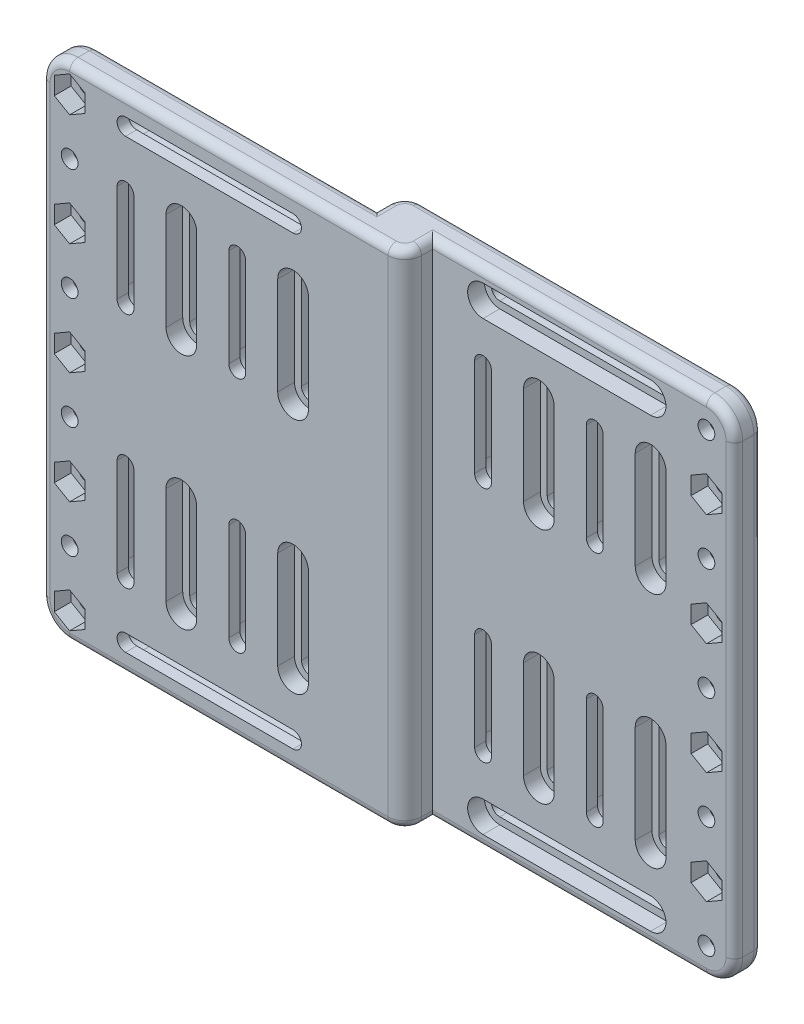
from build123d import *

# Parameters (mm, degrees)
EXTRUDE_2_DEPTH              = 5
EXTRUDE_3_DEPTH              = 5
SKETCH_4_R                   = 1.5
CUT_EXTRUDE_1_DEPTH          = 76.663729752
CUT_EXTRUDE_2_DEPTH          = 3
SKETCH_6_R                   = 1.5
CUT_EXTRUDE_3_DEPTH          = 76.663729752
CUT_EXTRUDE_4_DEPTH          = 3
PATTERN_LINEAR_1_COUNT       = 5
PATTERN_LINEAR_1_PITCH       = 10
PATTERN_LINEAR_1_COL_COUNT   = 5
PATTERN_LINEAR_1_COL_PITCH   = 10
PATTERN_LINEAR_2_COUNT       = 5
PATTERN_LINEAR_2_PITCH       = 10
PATTERN_LINEAR_2_COL_COUNT   = 5
PATTERN_LINEAR_2_COL_PITCH   = 10
PATTERN_LINEAR_9_COUNT       = 3
PATTERN_LINEAR_9_PITCH       = 20
PATTERN_LINEAR_9_COL_COUNT   = 3
PATTERN_LINEAR_9_COL_PITCH   = 20
PATTERN_LINEAR_10_COUNT      = 3
PATTERN_LINEAR_10_PITCH      = 20
PATTERN_LINEAR_10_COL_COUNT  = 3
PATTERN_LINEAR_10_COL_PITCH  = 20
CUT_EXTRUDE_15_DEPTH         = 3
CUT_EXTRUDE_16_DEPTH         = 3
PATTERN_LINEAR_11_COUNT      = 3
PATTERN_LINEAR_11_PITCH      = 20
PATTERN_LINEAR_11_COUNT_DIR2 = 3
PATTERN_LINEAR_11_PITCH_DIR2 = 20
PATTERN_LINEAR_12_COUNT      = 3
PATTERN_LINEAR_12_PITCH      = 20
PATTERN_LINEAR_12_COUNT_DIR2 = 3
PATTERN_LINEAR_12_PITCH_DIR2 = 20
CUT_EXTRUDE_5_DEPTH          = 76.166481892
CUT_EXTRUDE_6_DEPTH          = 3
CUT_EXTRUDE_7_DEPTH          = 76.166481892
CUT_EXTRUDE_8_DEPTH          = 3
CUT_EXTRUDE_9_DEPTH          = 76.166481892
CUT_EXTRUDE_10_DEPTH         = 76.166481892
PATTERN_LINEAR_3_COUNT       = 4
PATTERN_LINEAR_3_PITCH       = 10
PATTERN_LINEAR_4_COUNT       = 4
PATTERN_LINEAR_4_PITCH       = 10
CUT_EXTRUDE_11_DEPTH         = 3
CUT_EXTRUDE_12_DEPTH         = 3
PATTERN_LINEAR_6_COUNT       = 2
PATTERN_LINEAR_6_PITCH       = 20
PATTERN_LINEAR_13_COUNT      = 2
PATTERN_LINEAR_13_PITCH      = 20
CUT_EXTRUDE_13_DEPTH         = 3
CUT_EXTRUDE_14_DEPTH         = 3
PATTERN_LINEAR_8_COUNT       = 2
PATTERN_LINEAR_8_PITCH       = 20
PATTERN_LINEAR_14_COUNT      = 2
PATTERN_LINEAR_14_PITCH      = 20
FILLET_2_R                   = 3
FILLET_3_R                   = 5
FILLET_4_R                   = 1.5


with BuildPart() as part:
    # 草图2 → 凸台-拉伸2 (new body)
    with BuildSketch(Plane.XY):
        Polygon((0, 45), (5, 45), (5, -45), (0, -45), (-60, -45), (-60, 45), align=None)
    extrude(amount=EXTRUDE_2_DEPTH)

    # 草图3 → 凸台-拉伸3 (add)
    with BuildSketch(Plane(origin=(0, 0, 0), x_dir=(-1, 0, 0), z_dir=(0, 0, -1))):
        Polygon((0, 45), (5, 45), (5, -45), (0, -45), (-59, -45), (-59, 45), align=None)
    extrude(amount=EXTRUDE_3_DEPTH)

    # 草图4 → 切除-拉伸1 (cut, through all)
    with BuildSketch(Plane(origin=(0, 0, -5), x_dir=(-1, 0, 0), z_dir=(0, 0, -1))):
        with Locations((-54, 0)):
            Circle(SKETCH_4_R)
    cut_extrude_1 = extrude(amount=-CUT_EXTRUDE_1_DEPTH, mode=Mode.SUBTRACT)

    # 草图5 → 切除-拉伸2 (cut)
    with BuildSketch(Plane(origin=(0, 0, -5), x_dir=(-1, 0, 0), z_dir=(0, 0, -1))):
        Polygon((-54, -3.175426481), (-51.25, -1.58771324), (-51.25, 1.58771324), (-54, 3.175426481), (-56.75, 1.58771324), (-56.75, -1.58771324), align=None)
    cut_extrude_2 = extrude(amount=-CUT_EXTRUDE_2_DEPTH, mode=Mode.SUBTRACT)

    # 草图6 → 切除-拉伸3 (cut, through all)
    with BuildSketch(Plane.XY.offset(5)):
        with Locations((-55, 0)):
            Circle(SKETCH_6_R)
    cut_extrude_3 = extrude(amount=-CUT_EXTRUDE_3_DEPTH, mode=Mode.SUBTRACT)

    # 草图7 → 切除-拉伸4 (cut)
    with BuildSketch(Plane.XY.offset(5)):
        Polygon((-55, 3.175426481), (-57.75, 1.58771324), (-57.75, -1.58771324), (-55, -3.175426481), (-52.25, -1.58771324), (-52.25, 1.58771324), align=None)
    cut_extrude_4 = extrude(amount=-CUT_EXTRUDE_4_DEPTH, mode=Mode.SUBTRACT)

    # 阵列(线性)1: 切除-拉伸1 ×5
    with Locations(*[(0, -i * PATTERN_LINEAR_1_PITCH, 0) for i in range(1, PATTERN_LINEAR_1_COUNT)]):
        add(cut_extrude_1, mode=Mode.SUBTRACT)

    # 阵列(线性)1 col: 切除-拉伸1 ×5
    with Locations(*[(0, i * PATTERN_LINEAR_1_COL_PITCH, 0) for i in range(1, PATTERN_LINEAR_1_COL_COUNT)]):
        add(cut_extrude_1, mode=Mode.SUBTRACT)

    # 阵列(线性)2: 切除-拉伸3 ×5
    with Locations(*[(0, -i * PATTERN_LINEAR_2_PITCH, 0) for i in range(1, PATTERN_LINEAR_2_COUNT)]):
        add(cut_extrude_3, mode=Mode.SUBTRACT)

    # 阵列(线性)2 col: 切除-拉伸3 ×5
    with Locations(*[(0, i * PATTERN_LINEAR_2_COL_PITCH, 0) for i in range(1, PATTERN_LINEAR_2_COL_COUNT)]):
        add(cut_extrude_3, mode=Mode.SUBTRACT)

    # 阵列(线性)9: 切除-拉伸2 ×3
    with Locations(*[(0, i * PATTERN_LINEAR_9_PITCH, 0) for i in range(1, PATTERN_LINEAR_9_COUNT)]):
        add(cut_extrude_2, mode=Mode.SUBTRACT)

    # 阵列(线性)9 col: 切除-拉伸2 ×3
    with Locations(*[(0, -i * PATTERN_LINEAR_9_COL_PITCH, 0) for i in range(1, PATTERN_LINEAR_9_COL_COUNT)]):
        add(cut_extrude_2, mode=Mode.SUBTRACT)

    # 阵列(线性)10: 切除-拉伸4 ×3
    with Locations(*[(0, i * PATTERN_LINEAR_10_PITCH, 0) for i in range(1, PATTERN_LINEAR_10_COUNT)]):
        add(cut_extrude_4, mode=Mode.SUBTRACT)

    # 阵列(线性)10 col: 切除-拉伸4 ×3
    with Locations(*[(0, -i * PATTERN_LINEAR_10_COL_PITCH, 0) for i in range(1, PATTERN_LINEAR_10_COL_COUNT)]):
        add(cut_extrude_4, mode=Mode.SUBTRACT)

    # 草图19 → 切除-拉伸15 (cut)
    with BuildSketch(Plane.XY):
        Polygon((54, 13.175426481), (51.25, 11.58771324), (51.25, 8.41228676), (54, 6.824573519), (56.75, 8.41228676), (56.75, 11.58771324), align=None)
    cut_extrude_15 = extrude(amount=-CUT_EXTRUDE_15_DEPTH, mode=Mode.SUBTRACT)

    # 草图20 → 切除-拉伸16 (cut)
    with BuildSketch(Plane(origin=(0, 0, 0), x_dir=(-1, 0, 0), z_dir=(0, 0, -1))):
        Polygon((55, 6.824573519), (57.75, 8.41228676), (57.75, 11.58771324), (55, 13.175426481), (52.25, 11.58771324), (52.25, 8.41228676), align=None)
    cut_extrude_16 = extrude(amount=-CUT_EXTRUDE_16_DEPTH, mode=Mode.SUBTRACT)

    # 阵列(线性)11: Cut-Extrude 15 3 × 3
    with Locations(*[Vector(0, -1, 0) * (i * PATTERN_LINEAR_11_PITCH) + Vector(0, 1, 0) * (j * PATTERN_LINEAR_11_PITCH_DIR2) for i in range(PATTERN_LINEAR_11_COUNT) for j in range(PATTERN_LINEAR_11_COUNT_DIR2) if (i, j) != (0, 0)]):
        add(cut_extrude_15, mode=Mode.SUBTRACT)

    # 阵列(线性)12: Cut-Extrude 16 3 × 3
    with Locations(*[Vector(0, -1, 0) * (i * PATTERN_LINEAR_12_PITCH) + Vector(0, 1, 0) * (j * PATTERN_LINEAR_12_PITCH_DIR2) for i in range(PATTERN_LINEAR_12_COUNT) for j in range(PATTERN_LINEAR_12_COUNT_DIR2) if (i, j) != (0, 0)]):
        add(cut_extrude_16, mode=Mode.SUBTRACT)

    # 草图9 → 切除-拉伸5 (cut, through all)
    with BuildSketch(Plane(origin=(0, 0, 0), x_dir=(-1, 0, 0), z_dir=(0, 0, -1))):
        with BuildLine():
            Line((15, 41.5), (45, 41.5))
            ThreePointArc((45, 41.5), (46.5, 40), (45, 38.5))
            Line((45, 38.5), (15, 38.5))
            ThreePointArc((15, 38.5), (13.5, 40), (15, 41.5))
        make_face()
        with BuildLine():
            Line((15, -41.5), (45, -41.5))
            ThreePointArc((45, -41.5), (46.5, -40), (45, -38.5))
            Line((45, -38.5), (15, -38.5))
            ThreePointArc((15, -38.5), (13.5, -40), (15, -41.5))
        make_face()
    extrude(amount=-CUT_EXTRUDE_5_DEPTH, mode=Mode.SUBTRACT)

    # 草图11 → 切除-拉伸6 (cut)
    with BuildSketch(Plane(origin=(0, 0, 0), x_dir=(-1, 0, 0), z_dir=(0, 0, -1))):
        with BuildLine():
            Line((15, 42.75), (45, 42.75))
            ThreePointArc((45, 42.75), (47.75, 40), (45, 37.25))
            Line((45, 37.25), (15, 37.25))
            ThreePointArc((15, 37.25), (12.25, 40), (15, 42.75))
        make_face()
        with BuildLine():
            Line((15, -37.25), (45, -37.25))
            ThreePointArc((45, -37.25), (47.75, -40), (45, -42.75))
            Line((45, -42.75), (15, -42.75))
            ThreePointArc((15, -42.75), (12.25, -40), (15, -37.25))
        make_face()
    extrude(amount=-CUT_EXTRUDE_6_DEPTH, mode=Mode.SUBTRACT)

    # 草图10 → 切除-拉伸7 (cut, through all)
    with BuildSketch(Plane.XY):
        with BuildLine():
            Line((14, 41.5), (44, 41.5))
            ThreePointArc((44, 41.5), (45.5, 40), (44, 38.5))
            Line((44, 38.5), (14, 38.5))
            ThreePointArc((14, 38.5), (12.5, 40), (14, 41.5))
        make_face()
        with BuildLine():
            Line((14, -41.5), (44, -41.5))
            ThreePointArc((44, -41.5), (45.5, -40), (44, -38.5))
            Line((44, -38.5), (14, -38.5))
            ThreePointArc((14, -38.5), (12.5, -40), (14, -41.5))
        make_face()
    extrude(amount=-CUT_EXTRUDE_7_DEPTH, mode=Mode.SUBTRACT)

    # 草图12 → 切除-拉伸8 (cut)
    with BuildSketch(Plane.XY):
        with BuildLine():
            Line((14, 42.75), (44, 42.75))
            ThreePointArc((44, 42.75), (46.75, 40), (44, 37.25))
            Line((44, 37.25), (14, 37.25))
            ThreePointArc((14, 37.25), (11.25, 40), (14, 42.75))
        make_face()
        with BuildLine():
            Line((14, -37.25), (44, -37.25))
            ThreePointArc((44, -37.25), (46.75, -40), (44, -42.75))
            Line((44, -42.75), (14, -42.75))
            ThreePointArc((14, -42.75), (11.25, -40), (14, -37.25))
        make_face()
    extrude(amount=-CUT_EXTRUDE_8_DEPTH, mode=Mode.SUBTRACT)

    # 草图13 → 切除-拉伸9 (cut, through all)
    with BuildSketch(Plane(origin=(0, 0, 0), x_dir=(-1, 0, 0), z_dir=(0, 0, -1))):
        with BuildLine():
            Line((16.5, 30), (16.5, 12.5))
            ThreePointArc((16.5, 12.5), (15, 11), (13.5, 12.5))
            Line((13.5, 12.5), (13.5, 30))
            ThreePointArc((13.5, 30), (15, 31.5), (16.5, 30))
        make_face()
        with BuildLine():
            Line((16.5, -30), (16.5, -12.5))
            ThreePointArc((16.5, -12.5), (15, -11), (13.5, -12.5))
            Line((13.5, -12.5), (13.5, -30))
            ThreePointArc((13.5, -30), (15, -31.5), (16.5, -30))
        make_face()
    cut_extrude_9 = extrude(amount=-CUT_EXTRUDE_9_DEPTH, mode=Mode.SUBTRACT)

    # 草图14 → 切除-拉伸10 (cut, through all)
    with BuildSketch(Plane.XY):
        with BuildLine():
            Line((12.5, 12.5), (12.5, 30))
            ThreePointArc((12.5, 30), (14, 31.5), (15.5, 30))
            Line((15.5, 30), (15.5, 12.5))
            ThreePointArc((15.5, 12.5), (14, 11), (12.5, 12.5))
        make_face()
        with BuildLine():
            Line((12.5, -12.5), (12.5, -30))
            ThreePointArc((12.5, -30), (14, -31.5), (15.5, -30))
            Line((15.5, -30), (15.5, -12.5))
            ThreePointArc((15.5, -12.5), (14, -11), (12.5, -12.5))
        make_face()
    cut_extrude_10 = extrude(amount=-CUT_EXTRUDE_10_DEPTH, mode=Mode.SUBTRACT)

    # 阵列(线性)3: 切除-拉伸9 ×4
    with Locations(*[(-i * PATTERN_LINEAR_3_PITCH, 0, 0) for i in range(1, PATTERN_LINEAR_3_COUNT)]):
        add(cut_extrude_9, mode=Mode.SUBTRACT)

    # 阵列(线性)4: 切除-拉伸10 ×4
    with Locations(*[(i * PATTERN_LINEAR_4_PITCH, 0, 0) for i in range(1, PATTERN_LINEAR_4_COUNT)]):
        add(cut_extrude_10, mode=Mode.SUBTRACT)

    # 草图15 → 切除-拉伸11 (cut)
    with BuildSketch(Plane(origin=(0, 0, 0), x_dir=(-1, 0, 0), z_dir=(0, 0, -1))):
        with BuildLine():
            Line((47.75, 30), (47.75, 12.5))
            ThreePointArc((47.75, 12.5), (45, 9.75), (42.25, 12.5))
            Line((42.25, 12.5), (42.25, 30))
            ThreePointArc((42.25, 30), (45, 32.75), (47.75, 30))
        make_face()
        with BuildLine():
            Line((47.75, -12.5), (47.75, -30))
            ThreePointArc((47.75, -30), (45, -32.75), (42.25, -30))
            Line((42.25, -30), (42.25, -12.5))
            ThreePointArc((42.25, -12.5), (45, -9.75), (47.75, -12.5))
        make_face()
    cut_extrude_11 = extrude(amount=-CUT_EXTRUDE_11_DEPTH, mode=Mode.SUBTRACT)

    # 草图16 → 切除-拉伸12 (cut)
    with BuildSketch(Plane.XY.offset(5)):
        with BuildLine():
            Line((-12.25, 30), (-12.25, 12.5))
            ThreePointArc((-12.25, 12.5), (-15, 9.75), (-17.75, 12.5))
            Line((-17.75, 12.5), (-17.75, 30))
            ThreePointArc((-17.75, 30), (-15, 32.75), (-12.25, 30))
        make_face()
        with BuildLine():
            Line((-12.25, -12.5), (-12.25, -30))
            ThreePointArc((-12.25, -30), (-15, -32.75), (-17.75, -30))
            Line((-17.75, -30), (-17.75, -12.5))
            ThreePointArc((-17.75, -12.5), (-15, -9.75), (-12.25, -12.5))
        make_face()
    cut_extrude_12 = extrude(amount=-CUT_EXTRUDE_12_DEPTH, mode=Mode.SUBTRACT)

    # 阵列(线性)6: 切除-拉伸12 ×2
    with Locations(*[(-i * PATTERN_LINEAR_6_PITCH, 0, 0) for i in range(1, PATTERN_LINEAR_6_COUNT)]):
        add(cut_extrude_12, mode=Mode.SUBTRACT)

    # 阵列(线性)13: 切除-拉伸11 ×2
    with Locations(*[(i * PATTERN_LINEAR_13_PITCH, 0, 0) for i in range(1, PATTERN_LINEAR_13_COUNT)]):
        add(cut_extrude_11, mode=Mode.SUBTRACT)

    # 草图17 → 切除-拉伸13 (cut)
    with BuildSketch(Plane.XY):
        with BuildLine():
            Line((46.75, 30), (46.75, 12.5))
            ThreePointArc((46.75, 12.5), (44, 9.75), (41.25, 12.5))
            Line((41.25, 12.5), (41.25, 30))
            ThreePointArc((41.25, 30), (44, 32.75), (46.75, 30))
        make_face()
        with BuildLine():
            Line((46.75, -12.5), (46.75, -30))
            ThreePointArc((46.75, -30), (44, -32.75), (41.25, -30))
            Line((41.25, -30), (41.25, -12.5))
            ThreePointArc((41.25, -12.5), (44, -9.75), (46.75, -12.5))
        make_face()
    cut_extrude_13 = extrude(amount=-CUT_EXTRUDE_13_DEPTH, mode=Mode.SUBTRACT)

    # 草图18 → 切除-拉伸14 (cut)
    with BuildSketch(Plane(origin=(0, 0, -5), x_dir=(-1, 0, 0), z_dir=(0, 0, -1))):
        with BuildLine():
            Line((-11.25, 30), (-11.25, 12.5))
            ThreePointArc((-11.25, 12.5), (-14, 9.75), (-16.75, 12.5))
            Line((-16.75, 12.5), (-16.75, 30))
            ThreePointArc((-16.75, 30), (-14, 32.75), (-11.25, 30))
        make_face()
        with BuildLine():
            Line((-11.25, -12.5), (-11.25, -30))
            ThreePointArc((-11.25, -30), (-14, -32.75), (-16.75, -30))
            Line((-16.75, -30), (-16.75, -12.5))
            ThreePointArc((-16.75, -12.5), (-14, -9.75), (-11.25, -12.5))
        make_face()
    cut_extrude_14 = extrude(amount=-CUT_EXTRUDE_14_DEPTH, mode=Mode.SUBTRACT)

    # 阵列(线性)8: 切除-拉伸14 ×2
    with Locations(*[(i * PATTERN_LINEAR_8_PITCH, 0, 0) for i in range(1, PATTERN_LINEAR_8_COUNT)]):
        add(cut_extrude_14, mode=Mode.SUBTRACT)

    # 阵列(线性)14: 切除-拉伸13 ×2
    with Locations(*[(-i * PATTERN_LINEAR_14_PITCH, 0, 0) for i in range(1, PATTERN_LINEAR_14_COUNT)]):
        add(cut_extrude_13, mode=Mode.SUBTRACT)

    # 圆角2
    fillet_2_edges = [part.edges().sort_by_distance(p)[0] for p in [
        (5, 0, 5),
        (-5, 0, -5),
    ]]
    fillet(fillet_2_edges, radius=FILLET_2_R)

    # 圆角3
    fillet_3_edges = [part.edges().sort_by_distance(p)[0] for p in [
        (-60, -45, 2.5),
        (-60, 45, 2.5),
        (59, 45, -2.5),
        (59, -45, -2.5),
    ]]
    fillet(fillet_3_edges, radius=FILLET_3_R)

    # 圆角4
    fillet_4_edges = [part.edges().sort_by_distance(p)[0] for p in [
        (26, 45, -5),
        (5, 45, 1),
        (-5, 45, -1),
        (-26.5, 45, 5),
        (4.121320344, 45, 4.121320344),
        (-4.121320344, 45, -4.121320344),
        (-5, -45, -1),
        (5, -45, 1),
        (4.121320344, -45, 4.121320344),
        (-4.121320344, -45, -4.121320344),
        (59, 0, 0),
        (59, 0, -5),
        (29.5, -45, 0),
        (57.535533906, -43.535533906, 0),
        (57.535533906, 43.535533906, 0),
        (26, -45, -5),
        (57.535533906, -43.535533906, -5),
        (57.535533906, 43.535533906, -5),
        (-60, 0, 0),
        (-60, 0, 5),
        (-30, -45, 0),
        (-58.535533906, -43.535533906, 0),
        (-58.535533906, 43.535533906, 0),
        (-26.5, -45, 5),
        (-58.535533906, -43.535533906, 5),
        (-58.535533906, 43.535533906, 5),
        (-30, 45, 0),
        (29.5, 45, 0),
    ]]
    fillet(fillet_4_edges, radius=FILLET_4_R)


solid = part.part
